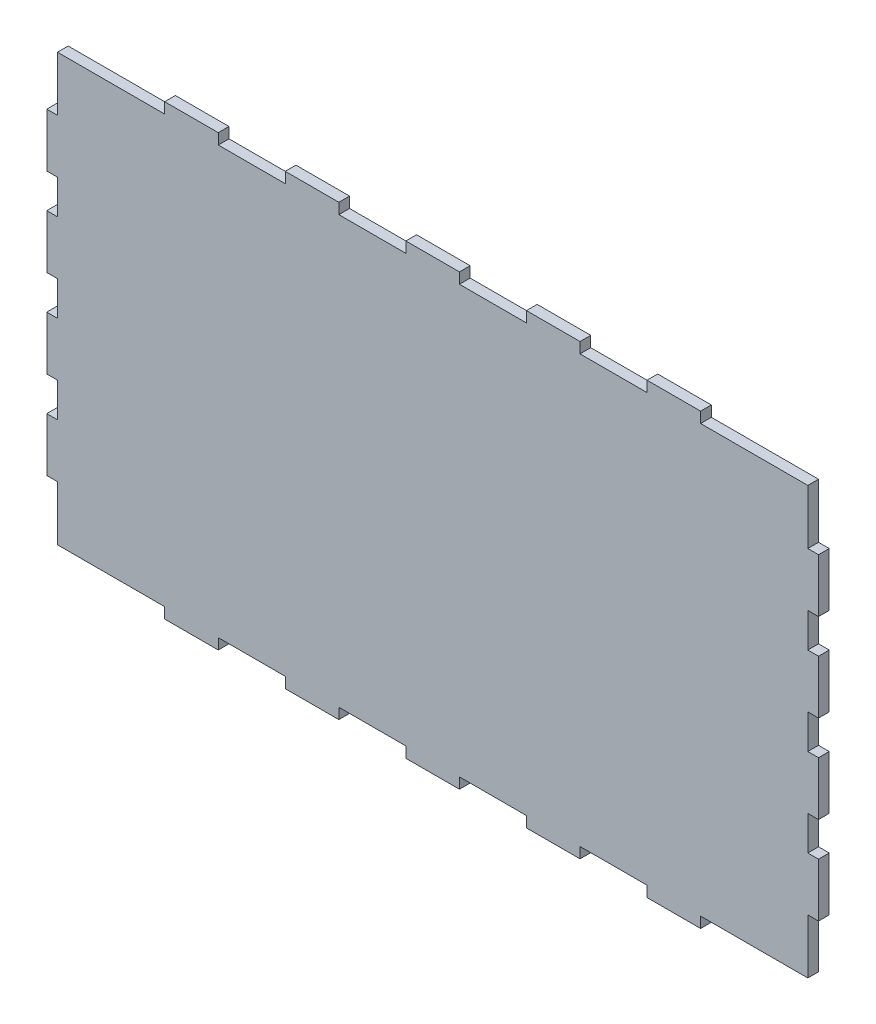
from build123d import *

# Parameters (mm, degrees)
SKETCH1_W           = 350
SKETCH1_H           = 199
BOSS_EXTRUDE1_DEPTH = 5
SKETCH2_W           = 5
SKETCH2_H           = 25
BOSS_EXTRUDE2_DEPTH = 5
SKETCH3_W           = 25
SKETCH3_H           = 5
BOSS_EXTRUDE3_DEPTH = 5


with BuildPart() as part:
    # Sketch1 → Boss-Extrude1 (new body)
    with BuildSketch(Plane.XY):
        Rectangle(SKETCH1_W, SKETCH1_H)
    extrude(amount=BOSS_EXTRUDE1_DEPTH)

    # Sketch2 → Boss-Extrude2 (add)
    with BuildSketch(Plane(origin=(175, 0, 0), x_dir=(0, 0, -1), z_dir=(1, 0, 0))):
        with Locations((-2.5, 61.5)):
            Rectangle(SKETCH2_W, SKETCH2_H)
        with Locations((-2.5, 20.5)):
            Rectangle(SKETCH2_W, SKETCH2_H)
        with Locations((-2.5, -20.5)):
            Rectangle(SKETCH2_W, SKETCH2_H)
        with Locations((-2.5, -61.5)):
            Rectangle(SKETCH2_W, SKETCH2_H)
    boss_extrude2 = extrude(amount=BOSS_EXTRUDE2_DEPTH)

    # Mirror1: Boss-Extrude2 across plane
    add(boss_extrude2.mirror(Plane(origin=(0, 0, 0), x_dir=(0, 0, 1), z_dir=(1, 0, 0))))

    # Sketch3 → Boss-Extrude3 (add)
    with BuildSketch(Plane(origin=(0, 99.5, 0), x_dir=(1, 0, 0), z_dir=(0, 1, 0))):
        with Locations((-112.5, -2.5)):
            Rectangle(SKETCH3_W, SKETCH3_H)
        with Locations((-56.25, -2.5)):
            Rectangle(SKETCH3_W, SKETCH3_H)
        with Locations((0, -2.5)):
            Rectangle(SKETCH3_W, SKETCH3_H)
        with Locations((56.25, -2.5)):
            Rectangle(SKETCH3_W, SKETCH3_H)
        with Locations((112.5, -2.5)):
            Rectangle(SKETCH3_W, SKETCH3_H)
    boss_extrude3 = extrude(amount=BOSS_EXTRUDE3_DEPTH)

    # Mirror2: Boss-Extrude3 across plane
    add(boss_extrude3.mirror(Plane.ZX))


solid = part.part
